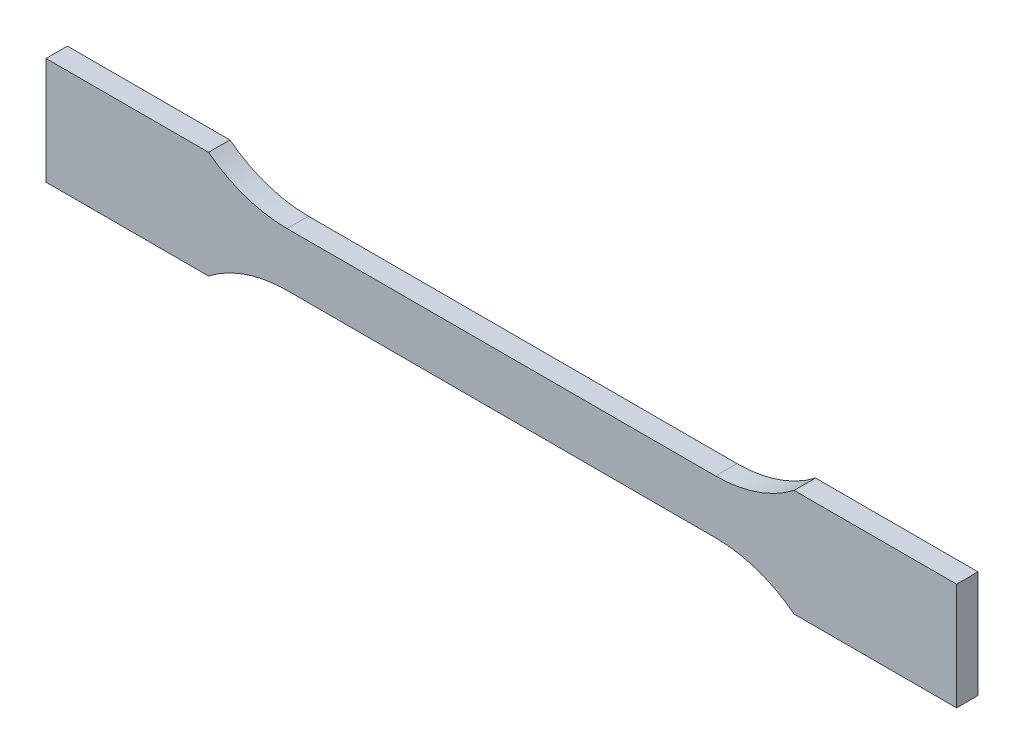
from build123d import *

# Parameters (mm, degrees)
BOSS_EXTRUDE1_DEPTH = 2


with BuildPart() as part:
    # Sketch1 → Boss-Extrude1 (new, symmetric)
    with BuildSketch(Plane.XY):
        with BuildLine():
            Line((-85, 10), (-85, -10))
            Line((-85, -10), (-54.662878299, -10))
            ThreePointArc((-54.662878299, -10), (-47.745966692, -6.284366617), (-40, -5))
            Line((-40, -5), (40, -5))
            ThreePointArc((40, -5), (47.745966692, -6.284366617), (54.662878299, -10))
            Line((54.662878299, -10), (85, -10))
            Line((85, -10), (85, 10))
            Line((85, 10), (54.662878299, 10))
            ThreePointArc((54.662878299, 10), (47.745966692, 6.284366617), (40, 5))
            Line((40, 5), (-40, 5))
            ThreePointArc((-40, 5), (-47.745966692, 6.284366617), (-54.662878299, 10))
            Line((-54.662878299, 10), (-85, 10))
        make_face()
    extrude(amount=BOSS_EXTRUDE1_DEPTH, both=True)


solid = part.part
